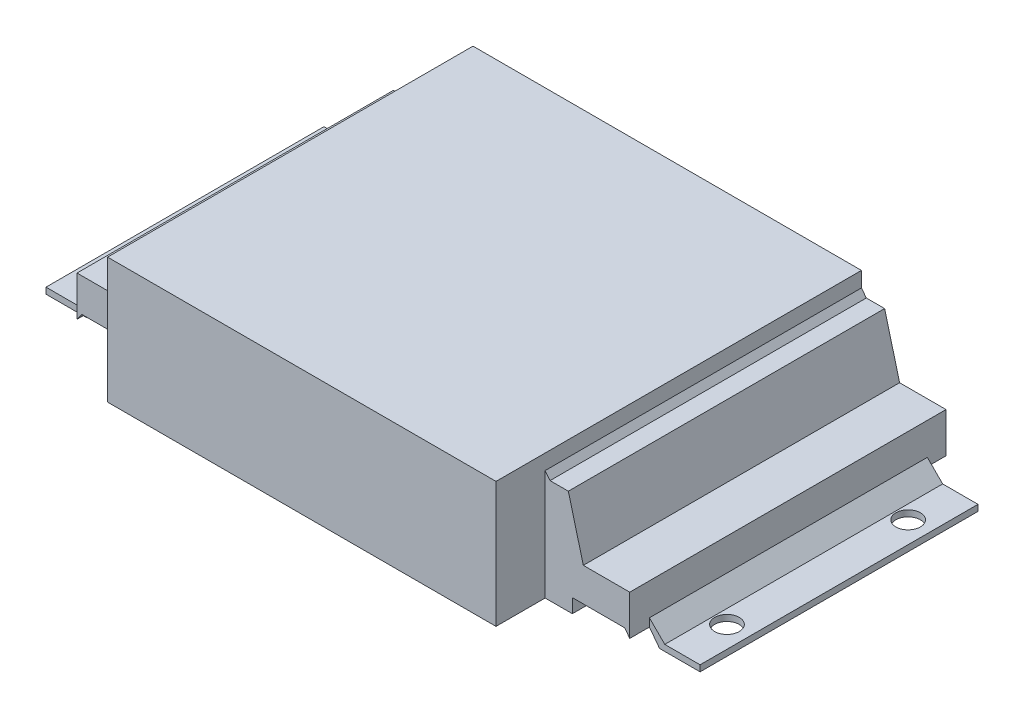
from build123d import *

# Parameters (mm, degrees)
SKETCH7_W           = 213
SKETCH7_H           = 90.5
BOSS_EXTRUDE1_DEPTH = 2
BOSS_EXTRUDE2_DEPTH = 40.9
CHAMFER1_SIZE       = 5
CUT_EXTRUDE1_DEPTH  = 166.359184807
CUT_EXTRUDE2_DEPTH  = 166.359184807
SKETCH11_R          = 4
CUT_EXTRUDE3_DEPTH  = 40.9


with BuildPart() as part:
    # Sketch7 → Boss-Extrude1 (new body)
    with BuildSketch(Plane(origin=(0, 0, 0), x_dir=(1, 0, 0), z_dir=(0, 1, 0))):
        with Locations((0, 8.157414363)):
            Rectangle(SKETCH7_W, SKETCH7_H)
    extrude(amount=BOSS_EXTRUDE1_DEPTH)

    # Sketch8 → Boss-Extrude2 (add)
    with BuildSketch(Plane(origin=(0, 2, 0), x_dir=(1, 0, 0), z_dir=(0, 1, 0))):
        Polygon((-90, 59.5), (-90, -43.5), (-64.043073189, -43.5), (-64.043073189, -59.5), (62.450636704, -59.5), (62.450636704, -43.5), (90, -43.5), (90, 59.5), align=None)
    extrude(amount=BOSS_EXTRUDE2_DEPTH)

    # Chamfer1
    chamfer1_edges = [part.edges().sort_by_distance(p)[0] for p in [
        (90, 2, -8.157414363),
        (-90, 2, -8.157414363),
    ]]
    chamfer(chamfer1_edges, length=CHAMFER1_SIZE)

    # Sketch9 → Cut-Extrude1 (cut, through all)
    with BuildSketch(Plane.XY.offset(59.5)):
        Polygon((-93.291667838, 0), (-88.36780993, 6.554671328), (-71.309248996, 6.554671328), (-71.309248996, 1.137273466), (71.309248996, 1.137273466), (71.309248996, 6.554671328), (88.36780993, 6.554671328), (93.291667838, 0), (93.291667838, -4.012269233), (-93.291667838, -4.012269233), align=None)
    extrude(amount=-CUT_EXTRUDE1_DEPTH, mode=Mode.SUBTRACT)

    # Sketch10 → Cut-Extrude2 (cut, through all)
    with BuildSketch(Plane.XY.offset(59.5)):
        Polygon((-90, 53.559109073), (-90, 17.435932261), (-74.881220668, 17.435932261), (-70.000468563, 35.913866357), (-64.043073189, 35.913866357), (-64.043073189, 42.9), (-58.569611619, 42.9), (58.569611619, 42.9), (62.450636704, 42.9), (62.450636704, 37.946396222), (64.043073189, 35.913866357), (70.000468563, 35.913866357), (74.881220668, 17.435932261), (90, 17.435932261), (90, 53.559109073), align=None)
    extrude(amount=-CUT_EXTRUDE2_DEPTH, mode=Mode.SUBTRACT)

    # Sketch11 → Cut-Extrude3 (cut)
    with BuildSketch(Plane(origin=(0, 2, 0), x_dir=(1, 0, 0), z_dir=(0, 1, 0))):
        with Locations(Location((99.5, 37.657414363, 0), (0, 0, 270))):
            Circle(SKETCH11_R)
        with Locations(Location((-99.5, 37.657414363, 0), (0, 0, 270))):
            Circle(SKETCH11_R)
        with Locations(Location((-99.5, -21.342585637, 0), (0, 0, 90))):
            Circle(SKETCH11_R)
        with Locations(Location((99.5, -21.342585637, 0), (0, 0, 90))):
            Circle(SKETCH11_R)
    extrude(amount=-CUT_EXTRUDE3_DEPTH, mode=Mode.SUBTRACT)


solid = part.part
